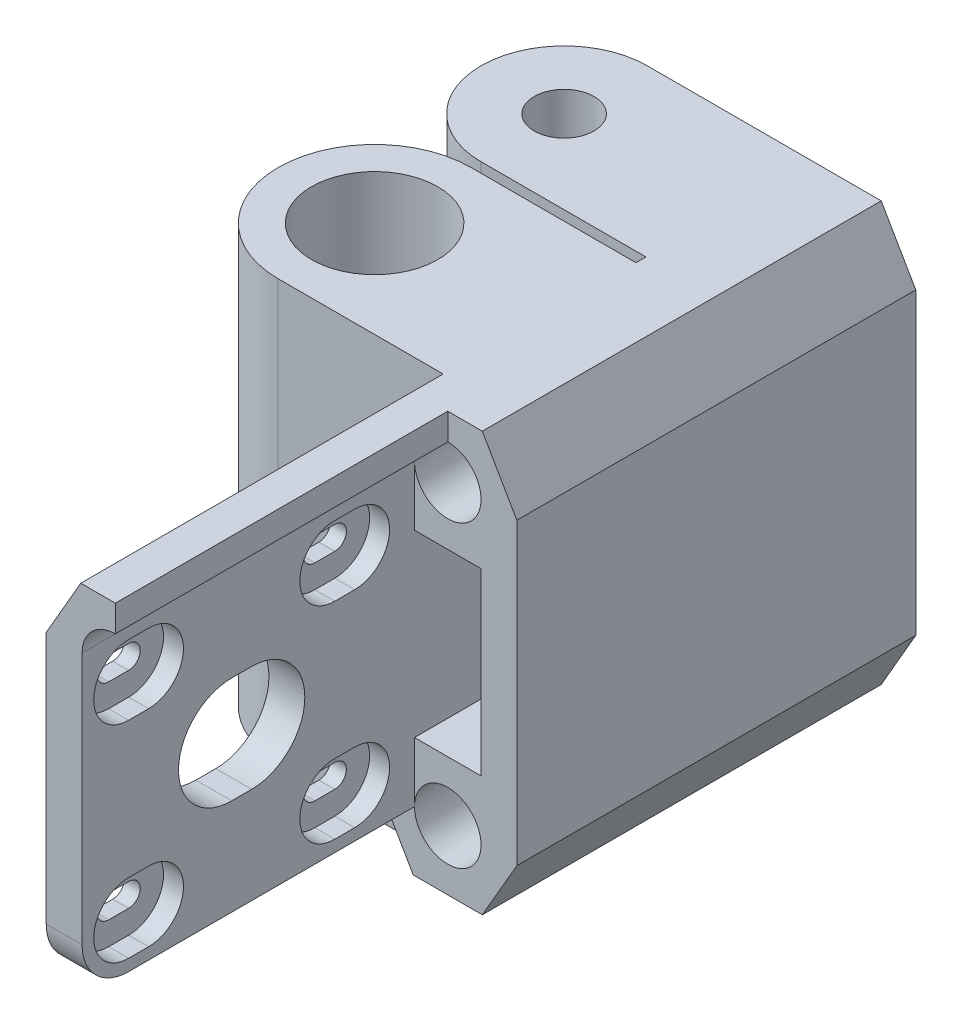
from build123d import *

# Parameters (mm, degrees)
SKETCH1_R           = 5
SKETCH1_W           = 10
SKETCH1_H           = 27
BOSS_EXTRUDE1_DEPTH = 60
BOSS_EXTRUDE2_REACH = 89.618
SKETCH2_R           = 4.5
CUT_EXTRUDE1_DEPTH  = 7
BOSS_EXTRUDE3_START = -63
SKETCH4_R           = 9.5
BOSS_EXTRUDE3_DEPTH = 63
BOSS_EXTRUDE5_DEPTH = 50
CUT_EXTRUDE16_DEPTH = 20
CUT_EXTRUDE2_DEPTH  = 3
FILLET1_R           = 7


with BuildPart() as part:
    # Sketch1 → Boss-Extrude1 (new body)
    with BuildSketch(Plane.XY):
        Polygon((-10.392304845, 22.5), (-10.392304845, -22.5), (-5.196152423, -31.5), (5.196152423, -31.5), (10.392304845, -22.5), (10.392304845, 22.5), (5.196152423, 31.5), (-5.196152423, 31.5), align=None)
        with Locations((0, 22.5)):
            Circle(SKETCH1_R, mode=Mode.SUBTRACT)
        with Locations((0, -22.5)):
            Circle(SKETCH1_R, mode=Mode.SUBTRACT)
        Rectangle(SKETCH1_W, SKETCH1_H, mode=Mode.SUBTRACT)
    extrude(amount=BOSS_EXTRUDE1_DEPTH)

    # Boss-Extrude2: up to this face of the body (flat: up to its plane)
    boss_extrude2_end = Plane(part.part.faces().sort_by_distance((0, 13.5, 30))[0])
    # Sketch2 → Boss-Extrude2 (add, up to the picked face)
    with BuildSketch(Plane.XZ.offset(-31.5), mode=Mode.PRIVATE) as boss_extrude2_sk1:
        with BuildLine():
            Line((-30, 25), (-5.196152423, 25))
            Line((-5.196152423, 25), (-5.196152423, 0))
            Line((-5.196152423, 0), (-30, 0))
            ThreePointArc((-30, 0), (-42.5, 12.5), (-30, 25))
        make_face()
        with Locations((-30, 12.5)):
            Circle(SKETCH2_R, mode=Mode.SUBTRACT)
    boss_extrude2_tool1 = split(extrude(boss_extrude2_sk1.sketch, amount=BOSS_EXTRUDE2_REACH, mode=Mode.PRIVATE), bisect_by=boss_extrude2_end, keep=Keep.BOTH, mode=Mode.PRIVATE)
    add(boss_extrude2_tool1.solids().sort_by(Axis((-22.0337, 31.5, 12.5), (0, -1, 0)))[0])

    # Sketch3 → Cut-Extrude1 (cut)
    with BuildSketch(Plane(origin=(0, 13.5, 0), x_dir=(-1, 0, 0), z_dir=(0, -1, 0))):
        Polygon((33.75277675, -6), (26.24722325, -6), (22.494446501, -12.5), (26.24722325, -19), (33.75277675, -19), (37.505553499, -12.5), align=None)
    extrude(amount=-CUT_EXTRUDE1_DEPTH, mode=Mode.SUBTRACT)

    # Sketch4 → Boss-Extrude3 (add)
    with BuildSketch(Plane.XZ.offset(31.5).offset(BOSS_EXTRUDE3_START)):
        with BuildLine():
            Line((-30, 55.5), (-5.196152423, 55.5))
            Line((-5.196152423, 55.5), (-5.196152423, 26.5))
            Line((-5.196152423, 26.5), (-30, 26.5))
            ThreePointArc((-30, 26.5), (-44.5, 41), (-30, 55.5))
        make_face()
        with Locations(Location((-30, 41, 0), (0, 0, 270))):
            Circle(SKETCH4_R, mode=Mode.SUBTRACT)
    extrude(amount=BOSS_EXTRUDE3_DEPTH)

    # Sketch34 → Boss-Extrude5 (add)
    with BuildSketch(Plane.XY.offset(60)):
        with BuildLine():
            Line((-10.392304845, 22.5), (-10.392304845, -22.5))
            Line((-10.392304845, -22.5), (-5, -22.5))
            Line((-5, -22.5), (-5, 22.5))
            ThreePointArc((-5, 22.5), (-3.535533906, 26.035533906), (0, 27.5))
            Line((0, 27.5), (0, 31.5))
            Line((0, 31.5), (-5.196152423, 31.5))
            Line((-5.196152423, 31.5), (-10.392304845, 22.5))
        make_face()
    extrude(amount=BOSS_EXTRUDE5_DEPTH)

    # Sketch26 → Cut-Extrude16 (cut)
    with BuildSketch(Plane(origin=(-5, -6.617020142, 13.078335781), x_dir=(0, 0, -1), z_dir=(1, 0, 0))):
        with BuildLine():
            Line((-89.921664219, 23.867020142), (-86.921664219, 23.867020142))
            ThreePointArc((-86.921664219, 23.867020142), (-85.171664219, 22.117020142), (-86.921664219, 20.367020142))
            Line((-86.921664219, 20.367020142), (-89.921664219, 20.367020142))
            ThreePointArc((-89.921664219, 20.367020142), (-91.671664219, 22.117020142), (-89.921664219, 23.867020142))
        make_face()
        with BuildLine():
            Line((-58.921664219, 23.867020142), (-55.921664219, 23.867020142))
            ThreePointArc((-55.921664219, 23.867020142), (-54.171664219, 22.117020142), (-55.921664219, 20.367020142))
            Line((-55.921664219, 20.367020142), (-58.921664219, 20.367020142))
            ThreePointArc((-58.921664219, 20.367020142), (-60.671664219, 22.117020142), (-58.921664219, 23.867020142))
        make_face()
        with BuildLine():
            Line((-58.921664219, -7.132979858), (-55.921664219, -7.132979858))
            ThreePointArc((-55.921664219, -7.132979858), (-54.171664219, -8.882979858), (-55.921664219, -10.632979858))
            Line((-55.921664219, -10.632979858), (-58.921664219, -10.632979858))
            ThreePointArc((-58.921664219, -10.632979858), (-60.671664219, -8.882979858), (-58.921664219, -7.132979858))
        make_face()
        with BuildLine():
            Line((-89.921664219, -7.132979858), (-86.921664219, -7.132979858))
            ThreePointArc((-86.921664219, -7.132979858), (-85.171664219, -8.882979858), (-86.921664219, -10.632979858))
            Line((-86.921664219, -10.632979858), (-89.921664219, -10.632979858))
            ThreePointArc((-89.921664219, -10.632979858), (-91.671664219, -8.882979858), (-89.921664219, -7.132979858))
        make_face()
        with BuildLine():
            Line((-74.421664219, 14.617020142), (-71.421664219, 14.617020142))
            ThreePointArc((-71.421664219, 14.617020142), (-63.421664219, 6.617020142), (-71.421664219, -1.382979858))
            Line((-71.421664219, -1.382979858), (-74.421664219, -1.382979858))
            ThreePointArc((-74.421664219, -1.382979858), (-82.421664219, 6.617020142), (-74.421664219, 14.617020142))
        make_face()
    extrude(amount=-CUT_EXTRUDE16_DEPTH, mode=Mode.SUBTRACT)

    # Sketch37 → Cut-Extrude2 (cut)
    with BuildSketch(Plane(origin=(-5, 8.494761854, 122.050976771), x_dir=(0, 0, -1), z_dir=(1, 0, 0))):
        with BuildLine():
            Line((22.050976771, 12.255238146), (19.050976771, 12.255238146))
            ThreePointArc((19.050976771, 12.255238146), (13.800976771, 7.005238146), (19.050976771, 1.755238146))
            Line((19.050976771, 1.755238146), (22.050976771, 1.755238146))
            ThreePointArc((22.050976771, 1.755238146), (27.300976771, 7.005238146), (22.050976771, 12.255238146))
        make_face()
        with BuildLine():
            Line((53.050976771, 12.255238146), (50.050976771, 12.255238146))
            ThreePointArc((50.050976771, 12.255238146), (44.800976771, 7.005238146), (50.050976771, 1.755238146))
            Line((50.050976771, 1.755238146), (53.050976771, 1.755238146))
            ThreePointArc((53.050976771, 1.755238146), (58.300976771, 7.005238146), (53.050976771, 12.255238146))
        make_face()
        with BuildLine():
            Line((53.050976771, -18.744761854), (50.050976771, -18.744761854))
            ThreePointArc((50.050976771, -18.744761854), (44.800976771, -23.994761854), (50.050976771, -29.244761854))
            Line((50.050976771, -29.244761854), (53.050976771, -29.244761854))
            ThreePointArc((53.050976771, -29.244761854), (58.300976771, -23.994761854), (53.050976771, -18.744761854))
        make_face()
        with BuildLine():
            Line((19.050976771, -29.244761854), (22.050976771, -29.244761854))
            ThreePointArc((22.050976771, -29.244761854), (27.300976771, -23.994761854), (22.050976771, -18.744761854))
            Line((22.050976771, -18.744761854), (19.050976771, -18.744761854))
            ThreePointArc((19.050976771, -18.744761854), (13.800976771, -23.994761854), (19.050976771, -29.244761854))
        make_face()
    extrude(amount=-CUT_EXTRUDE2_DEPTH, mode=Mode.SUBTRACT)

    # Fillet1
    fillet1_edges = [part.edges().sort_by_distance(p)[0] for p in [
        (-7.696152423, -22.5, 110),
    ]]
    fillet(fillet1_edges, radius=FILLET1_R)


solid = part.part
